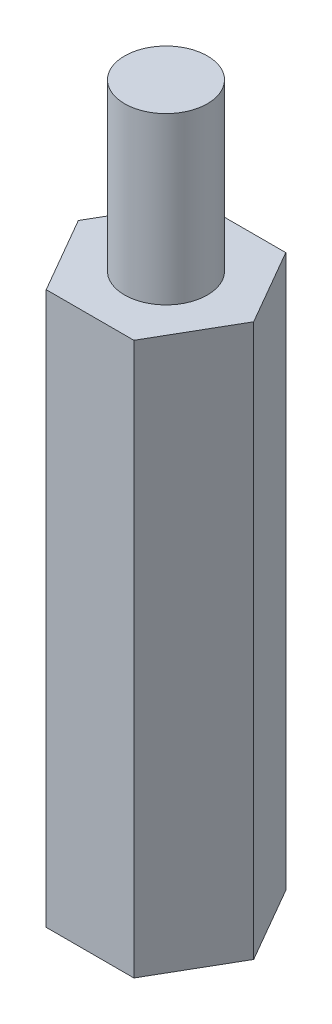
from build123d import *

# Parameters (mm, degrees)
EXTRUDE_1_DEPTH = 20
SKETCH_2_R      = 1.5
EXTRUDE_2_DEPTH = 6
M3X0_5_1_D      = 2.5
M3X0_5_1_DEPTH  = 8.5
M3X0_5_1_TIP    = 0.751075774


with BuildPart() as part:
    # ｽｹｯﾁ1 → ﾎﾞｽ - 押し出し1 (new body)
    with BuildSketch(Plane(origin=(0, 0, 0), x_dir=(1, 0, 0), z_dir=(0, 1, 0))):
        Polygon((1.58771324, -2.75), (3.175426481, 0), (1.58771324, 2.75), (-1.58771324, 2.75), (-3.175426481, 0), (-1.58771324, -2.75), align=None)
    extrude(amount=EXTRUDE_1_DEPTH)

    # ｽｹｯﾁ2 → ﾎﾞｽ - 押し出し2 (add)
    with BuildSketch(Plane(origin=(0, 20, 0), x_dir=(1, 0, 0), z_dir=(0, 1, 0))):
        with Locations(Location((0, 0, 0), (0, 0, 270))):
            Circle(SKETCH_2_R)
    extrude(amount=EXTRUDE_2_DEPTH)

    # M3x0.5 ねじ穴1
    with Locations(Plane(origin=(0, 0, 0), x_dir=(0, 0, -1), z_dir=(0, -1, 0))):
        with Locations((0, 0)):
            Hole(M3X0_5_1_D / 2, depth=M3X0_5_1_DEPTH)
            with Locations((0, 0, -(M3X0_5_1_DEPTH + M3X0_5_1_TIP / 2))):  # 118° drill point
                Cone(0, M3X0_5_1_D / 2, M3X0_5_1_TIP, mode=Mode.SUBTRACT)


solid = part.part
